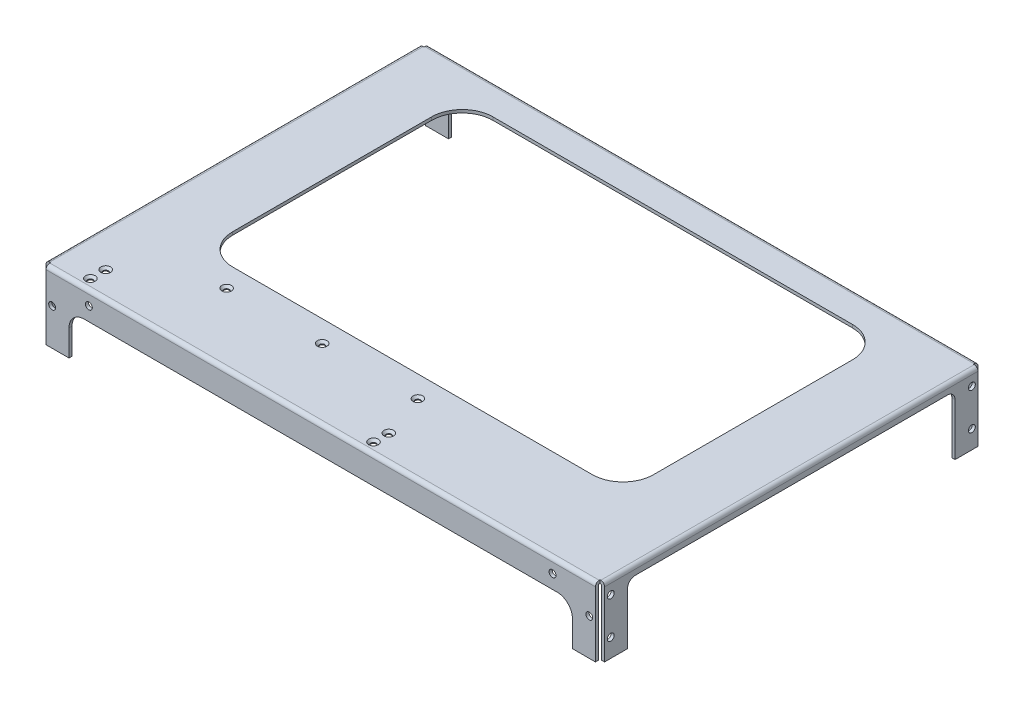
from build123d import *

# Parameters (mm, degrees)
BOSS_EXTRUDE1_DEPTH                             = 182.5
CUT_EXTRUDE1_DEPTH                              = 313.779874672
CUT_EXTRUDE2_DEPTH                              = 10
SKETCH4_W                                       = 2
SKETCH4_H                                       = 246
BOSS_EXTRUDE2_DEPTH                             = 43
SKETCH5_W                                       = 3
SKETCH5_H                                       = 3
CUT_EXTRUDE3_DEPTH                              = 226.734910902
FILLET1_R                                       = 0.5
FILLET2_R                                       = 2.5
CUT_EXTRUDE6_DEPTH                              = 389.426312188
SKETCH9_R                                       = 2.25
CUT_EXTRUDE7_DEPTH                              = 389.426312188
SKETCH10_R                                      = 2.25
CUT_EXTRUDE8_DEPTH                              = 10
CUT_EXTRUDE9_START                              = -10
SKETCH11_R                                      = 2.25
CUT_EXTRUDE9_DEPTH                              = 10
SKETCH12_R                                      = 1.5
CUT_EXTRUDE10_DEPTH                             = 10
CSK_FOR_M3_FLAT_HEAD_MACHINE_SCREW1_D           = 3.4
CSK_FOR_M3_FLAT_HEAD_MACHINE_SCREW1_CSINK_D     = 6.3
CSK_FOR_M3_FLAT_HEAD_MACHINE_SCREW1_CSINK_ANGLE = 90


with BuildPart() as part:
    # Sketch1 → Boss-Extrude1 (new, symmetric)
    with BuildSketch(Plane(origin=(0, 0, 0), x_dir=(0, 0, -1), z_dir=(1, 0, 0))):
        with BuildLine():
            Line((123, -45), (125, -45))
            Line((125, -45), (125, -2.5))
            ThreePointArc((125, -2.5), (124.267766953, -0.732233047), (122.5, 0))
            Line((122.5, 0), (-122.5, 0))
            ThreePointArc((-122.5, 0), (-124.267766953, -0.732233047), (-125, -2.5))
            Line((-125, -2.5), (-125, -45))
            Line((-125, -45), (-123, -45))
            Line((-123, -45), (-123, -2.5))
            ThreePointArc((-123, -2.5), (-122.853553391, -2.146446609), (-122.5, -2))
            Line((-122.5, -2), (122.5, -2))
            ThreePointArc((122.5, -2), (122.853553391, -2.146446609), (123, -2.5))
            Line((123, -2.5), (123, -45))
        make_face()
    extrude(amount=BOSS_EXTRUDE1_DEPTH, both=True)

    # Sketch2 → Cut-Extrude1 (cut, through all)
    with BuildSketch(Plane.XY.offset(125)):
        with BuildLine():
            Line((-164.5, -45), (164.5, -45))
            Line((164.5, -45), (164.5, -28))
            ThreePointArc((164.5, -28), (161.571067812, -20.928932188), (154.5, -18))
            Line((154.5, -18), (-154.5, -18))
            ThreePointArc((-154.5, -18), (-161.571067812, -20.928932188), (-164.5, -28))
            Line((-164.5, -28), (-164.5, -45))
        make_face()
    extrude(amount=-CUT_EXTRUDE1_DEPTH, mode=Mode.SUBTRACT)

    # Sketch3 → Cut-Extrude2 (cut)
    with BuildSketch(Plane(origin=(0, 0, 0), x_dir=(1, 0, 0), z_dir=(0, 1, 0))):
        with BuildLine():
            Line((-117.5, 105), (117.5, 105))
            ThreePointArc((117.5, 105), (131.642135624, 99.142135624), (137.5, 85))
            Line((137.5, 85), (137.5, -45))
            ThreePointArc((137.5, -45), (131.642135624, -59.142135624), (117.5, -65))
            Line((117.5, -65), (-117.5, -65))
            ThreePointArc((-117.5, -65), (-131.642135624, -59.142135624), (-137.5, -45))
            Line((-137.5, -45), (-137.5, 85))
            ThreePointArc((-137.5, 85), (-131.642135624, 99.142135624), (-117.5, 105))
        make_face()
    extrude(amount=-CUT_EXTRUDE2_DEPTH, mode=Mode.SUBTRACT)

    # Sketch4 → Boss-Extrude2 (add)
    with BuildSketch(Plane.XZ.offset(2)):
        with Locations((-181.5, 0)):
            Rectangle(SKETCH4_W, SKETCH4_H)
        with Locations((181.5, 0)):
            Rectangle(SKETCH4_W, SKETCH4_H)
    extrude(amount=BOSS_EXTRUDE2_DEPTH)

    # Sketch5 → Cut-Extrude3 (cut, through all)
    with BuildSketch(Plane.XZ.offset(45)):
        with Locations((-181, 123.5)):
            Rectangle(SKETCH5_W, SKETCH5_H)
        with Locations((-181, -123.5)):
            Rectangle(SKETCH5_W, SKETCH5_H)
        with Locations((181, -123.5)):
            Rectangle(SKETCH5_W, SKETCH5_H)
        with Locations((181, 123.5)):
            Rectangle(SKETCH5_W, SKETCH5_H)
    extrude(amount=-CUT_EXTRUDE3_DEPTH, mode=Mode.SUBTRACT)

    # Fillet1
    fillet1_edges = [part.edges().sort_by_distance(p)[0] for p in [
        (-180.5, -2, 0),
        (180.5, -2, 0),
    ]]
    fillet(fillet1_edges, radius=FILLET1_R)

    # Fillet2
    fillet2_edges = [part.edges().sort_by_distance(p)[0] for p in [
        (-182.5, 0, 0),
        (182.5, 0, 0),
    ]]
    fillet(fillet2_edges, radius=FILLET2_R)

    # Sketch8 → Cut-Extrude6 (cut, through all)
    with BuildSketch(Plane.ZY.offset(182.5)):
        with BuildLine():
            Line((-107, -45), (107, -45))
            Line((107, -45), (107, -11))
            ThreePointArc((107, -11), (105.535533906, -7.464466094), (102, -6))
            Line((102, -6), (-102, -6))
            ThreePointArc((-102, -6), (-105.535533906, -7.464466094), (-107, -11))
            Line((-107, -11), (-107, -45))
        make_face()
    extrude(amount=-CUT_EXTRUDE6_DEPTH, mode=Mode.SUBTRACT)

    # Sketch9 → Cut-Extrude7 (cut, through all)
    with BuildSketch(Plane.ZY.offset(182.5)):
        with Locations((-118, -9)):
            Circle(SKETCH9_R)
        with Locations((-118, -33)):
            Circle(SKETCH9_R)
        with Locations((118, -9)):
            Circle(SKETCH9_R)
        with Locations((118, -33)):
            Circle(SKETCH9_R)
    extrude(amount=-CUT_EXTRUDE7_DEPTH, mode=Mode.SUBTRACT)

    # Sketch10 → Cut-Extrude8 (cut)
    with BuildSketch(Plane.XY.offset(125)):
        with Locations((-151.5, -9)):
            Circle(SKETCH10_R)
        with Locations((175.5, -21)):
            Circle(SKETCH10_R)
        with Locations((151.5, -9)):
            Circle(SKETCH10_R)
        with Locations((-175.5, -21)):
            Circle(SKETCH10_R)
    extrude(amount=-CUT_EXTRUDE8_DEPTH, mode=Mode.SUBTRACT)

    # Sketch11 → Cut-Extrude9 (cut)
    with BuildSketch(Plane(origin=(0, 0, -125), x_dir=(-1, 0, 0), z_dir=(0, 0, -1)).offset(CUT_EXTRUDE9_START)):
        with Locations(Location((-175.5, -21, 0), (0, 0, 180))):
            Circle(SKETCH11_R)
        with Locations(Location((-151.5, -9, 0), (0, 0, 180))):
            Circle(SKETCH11_R)
        with Locations(Location((151.5, -9, 0), (0, 0, 180))):
            Circle(SKETCH11_R)
        with Locations(Location((175.5, -21, 0), (0, 0, 180))):
            Circle(SKETCH11_R)
    extrude(amount=CUT_EXTRUDE9_DEPTH, mode=Mode.SUBTRACT)

    # Sketch12 → Cut-Extrude10 (cut)
    with BuildSketch(Plane(origin=(0, 0, 0), x_dir=(1, 0, 0), z_dir=(0, 1, 0))):
        with Locations(Location((-45, -79, 0), (0, 0, 270))):
            Circle(SKETCH12_R)
        with Locations(Location((17.5, -79, 0), (0, 0, 270))):
            Circle(SKETCH12_R)
        with Locations(Location((-107.5, -79, 0), (0, 0, 270))):
            Circle(SKETCH12_R)
        with Locations(Location((-157.5, -108, 0), (0, 0, 270))):
            Circle(SKETCH12_R)
        with Locations(Location((-157.5, -118, 0), (0, 0, 270))):
            Circle(SKETCH12_R)
        with Locations(Location((27.5, -108, 0), (0, 0, 270))):
            Circle(SKETCH12_R)
        with Locations(Location((27.5, -118, 0), (0, 0, 270))):
            Circle(SKETCH12_R)
    extrude(amount=-CUT_EXTRUDE10_DEPTH, mode=Mode.SUBTRACT)

    # CSK for M3 Flat Head Machine Screw1 (through all)
    with Locations(Plane(origin=(0, 0, 0), x_dir=(-1, 0, 0), z_dir=(0, 1, 0))):
        with Locations((107.5, 79), (45, 79), (-17.5, 79), (157.5, 108), (157.5, 118), (-27.5, 108), (-27.5, 118)):
            CounterSinkHole(CSK_FOR_M3_FLAT_HEAD_MACHINE_SCREW1_D / 2, CSK_FOR_M3_FLAT_HEAD_MACHINE_SCREW1_CSINK_D / 2, counter_sink_angle=CSK_FOR_M3_FLAT_HEAD_MACHINE_SCREW1_CSINK_ANGLE)


solid = part.part
